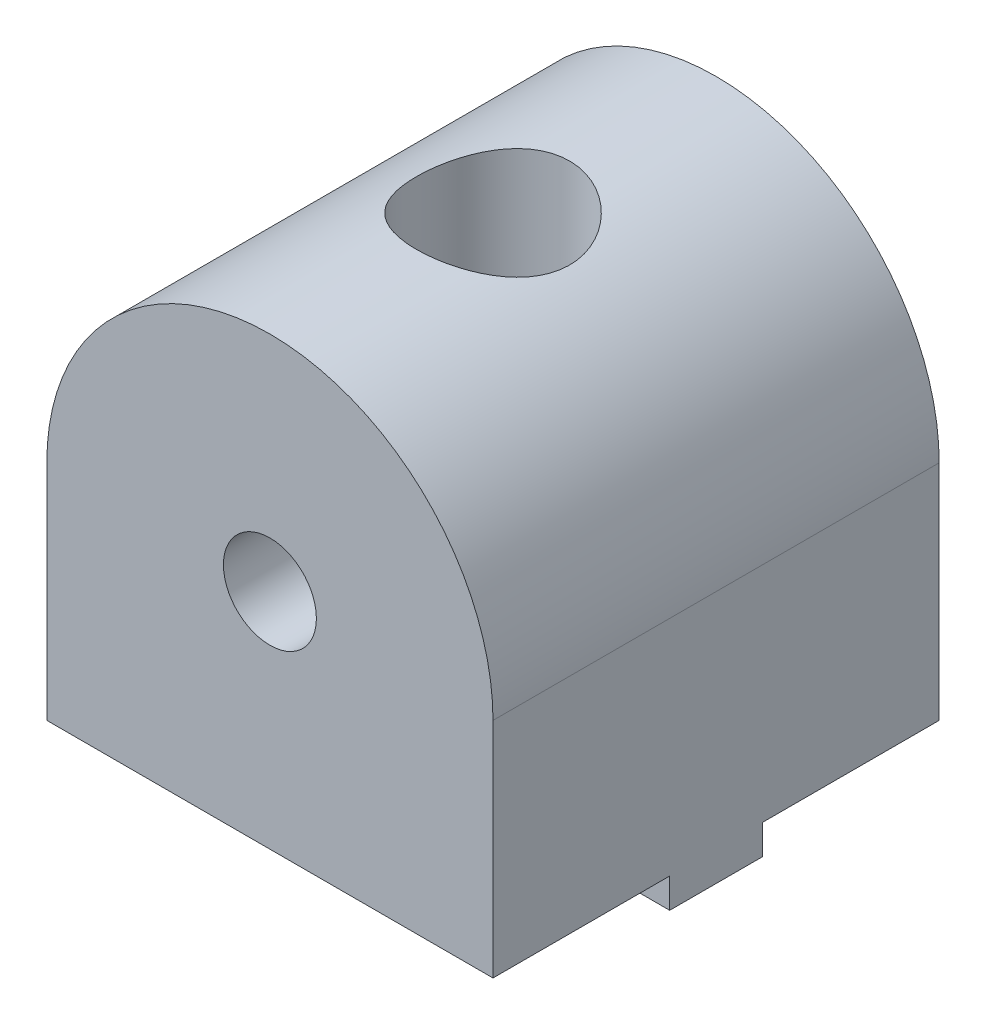
from build123d import *

# Parameters (mm, degrees)
SKETCH1_R          = 3.96875
EXTRUDE1_DEPTH     = 38.1
CUT_EXTRUDE1_DEPTH = 60.67726868
CUT_EXTRUDE2_START = -38.1
SKETCH3_R          = 6.5405
CUT_EXTRUDE2_DEPTH = 11.43
SKETCH4_W          = 7.9248
SKETCH4_H          = 7.9248
EXTRUDE2_DEPTH     = 2.54


with BuildPart() as part:
    # Sketch1 → Extrude1 (new body)
    with BuildSketch(Plane.XY):
        with BuildLine():
            Line((-12.445441008, 4.399037801), (-12.445441008, -14.650962199))
            Line((-12.445441008, -14.650962199), (25.654558992, -14.650962199))
            Line((25.654558992, -14.650962199), (25.654558992, 4.399037801))
            ThreePointArc((25.654558992, 4.399037801), (6.604558992, 23.449037801), (-12.445441008, 4.399037801))
        make_face()
        with Locations(Location((6.604558992, 4.399037801, 0), (0, 0, 180))):
            Circle(SKETCH1_R, mode=Mode.SUBTRACT)
    extrude(amount=EXTRUDE1_DEPTH)

    # Sketch2 → Cut-Extrude1 (cut, through all)
    with BuildSketch(Plane.XZ.offset(14.650962199)):
        with BuildLine():
            ThreePointArc((10.770158992, 19.05), (9.550083, 21.995524008), (6.604558992, 23.2156))
            Line((6.604558992, 23.2156), (6.604558992, 14.8844))
            ThreePointArc((6.604558992, 14.8844), (9.550083, 16.104475992), (10.770158992, 19.05))
        make_face()
        with BuildLine():
            Line((6.604558992, 14.8844), (6.604558992, 23.2156))
            ThreePointArc((6.604558992, 23.2156), (2.438958992, 19.05), (6.604558992, 14.8844))
        make_face()
    extrude(amount=-CUT_EXTRUDE1_DEPTH, mode=Mode.SUBTRACT)

    # Sketch3 → Cut-Extrude2 (cut)
    with BuildSketch(Plane.XZ.offset(14.650962199).offset(CUT_EXTRUDE2_START)):
        with Locations(Location((6.604558992, 19.05, 0), (0, 0, 90))):
            Circle(SKETCH3_R)
    extrude(amount=CUT_EXTRUDE2_DEPTH, mode=Mode.SUBTRACT)

    # Sketch4 → Extrude2 (add)
    with BuildSketch(Plane.XZ.offset(14.650962199)):
        with Locations((-8.483041008, 19.05)):
            Rectangle(SKETCH4_W, SKETCH4_H)
        with Locations((21.692158992, 19.05)):
            Rectangle(SKETCH4_W, SKETCH4_H)
    extrude(amount=EXTRUDE2_DEPTH)


solid = part.part
